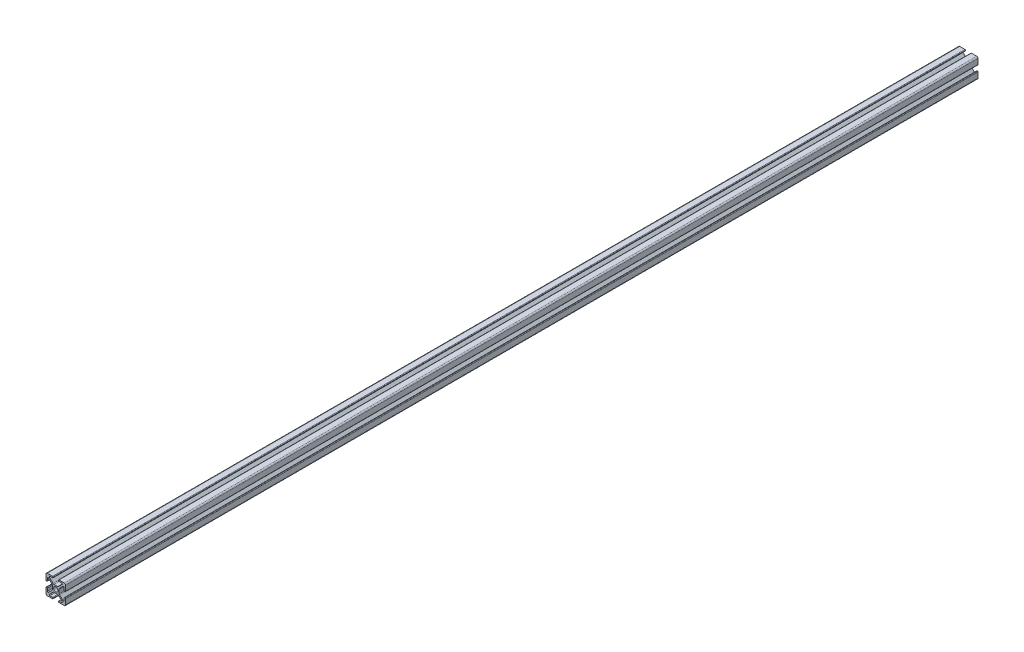
from build123d import *

# Parameters (mm, degrees)
SKETCH_1_R      = 3.35
EXTRUDE_1_DEPTH = 1400


with BuildPart() as part:
    # 草图1 → 凸台-拉伸1 (new body)
    with BuildSketch(Plane.XY):
        with BuildLine():
            Line((14.1, -4), (13.9, -4))
            ThreePointArc((13.9, -4), (13.263603897, -4.263603897), (13, -4.9))
            Line((13, -4.9), (13, -8.985786438))
            ThreePointArc((13, -8.985786438), (12.382683432, -9.90966597), (11.292893219, -9.692893219))
            Line((11.292893219, -9.692893219), (5.835786438, -4.235786438))
            ThreePointArc((5.835786438, -4.235786438), (5.402240935, -3.58693974), (5.25, -2.821572875))
            Line((5.25, -2.821572875), (5.25, 2.821572875))
            ThreePointArc((5.25, 2.821572875), (5.402240935, 3.58693974), (5.835786438, 4.235786438))
            Line((5.835786438, 4.235786438), (11.292893219, 9.692893219))
            ThreePointArc((11.292893219, 9.692893219), (12.382683432, 9.90966597), (13, 8.985786438))
            Line((13, 8.985786438), (13, 4.9))
            ThreePointArc((13, 4.9), (13.263603897, 4.263603897), (13.9, 4))
            Line((13.9, 4), (14.1, 4))
            ThreePointArc((14.1, 4), (14.736396103, 4.263603897), (15, 4.9))
            Line((15, 4.9), (15, 13))
            ThreePointArc((15, 13), (14.414213562, 14.414213562), (13, 15))
            Line((13, 15), (4.9, 15))
            ThreePointArc((4.9, 15), (4.263603897, 14.736396103), (4, 14.1))
            Line((4, 14.1), (4, 13.9))
            ThreePointArc((4, 13.9), (4.263603897, 13.263603897), (4.9, 13))
            Line((4.9, 13), (8.985786438, 13))
            ThreePointArc((8.985786438, 13), (9.90966597, 12.382683432), (9.692893219, 11.292893219))
            Line((9.692893219, 11.292893219), (4.235786438, 5.835786438))
            ThreePointArc((4.235786438, 5.835786438), (3.58693974, 5.402240935), (2.821572875, 5.25))
            Line((2.821572875, 5.25), (-2.821572875, 5.25))
            ThreePointArc((-2.821572875, 5.25), (-3.58693974, 5.402240935), (-4.235786438, 5.835786438))
            Line((-4.235786438, 5.835786438), (-9.692893219, 11.292893219))
            ThreePointArc((-9.692893219, 11.292893219), (-9.90966597, 12.382683432), (-8.985786438, 13))
            Line((-8.985786438, 13), (-4.9, 13))
            ThreePointArc((-4.9, 13), (-4.263603897, 13.263603897), (-4, 13.9))
            Line((-4, 13.9), (-4, 14.1))
            ThreePointArc((-4, 14.1), (-4.263603897, 14.736396103), (-4.9, 15))
            Line((-4.9, 15), (-13, 15))
            ThreePointArc((-13, 15), (-14.414213562, 14.414213562), (-15, 13))
            Line((-15, 13), (-15, 4.9))
            ThreePointArc((-15, 4.9), (-14.736396103, 4.263603897), (-14.1, 4))
            Line((-14.1, 4), (-13.9, 4))
            ThreePointArc((-13.9, 4), (-13.263603897, 4.263603897), (-13, 4.9))
            Line((-13, 4.9), (-13, 8.985786438))
            ThreePointArc((-13, 8.985786438), (-12.382683432, 9.90966597), (-11.292893219, 9.692893219))
            Line((-11.292893219, 9.692893219), (-5.835786438, 4.235786438))
            ThreePointArc((-5.835786438, 4.235786438), (-5.402240935, 3.58693974), (-5.25, 2.821572875))
            Line((-5.25, 2.821572875), (-5.25, -2.821572875))
            ThreePointArc((-5.25, -2.821572875), (-5.402240935, -3.58693974), (-5.835786438, -4.235786438))
            Line((-5.835786438, -4.235786438), (-11.292893219, -9.692893219))
            ThreePointArc((-11.292893219, -9.692893219), (-12.382683432, -9.90966597), (-13, -8.985786438))
            Line((-13, -8.985786438), (-13, -4.9))
            ThreePointArc((-13, -4.9), (-13.263603897, -4.263603897), (-13.9, -4))
            Line((-13.9, -4), (-14.1, -4))
            ThreePointArc((-14.1, -4), (-14.736396103, -4.263603897), (-15, -4.9))
            Line((-15, -4.9), (-15, -13))
            ThreePointArc((-15, -13), (-14.414213562, -14.414213562), (-13, -15))
            Line((-13, -15), (-4.9, -15))
            ThreePointArc((-4.9, -15), (-4.263603897, -14.736396103), (-4, -14.1))
            Line((-4, -14.1), (-4, -13.9))
            ThreePointArc((-4, -13.9), (-4.263603897, -13.263603897), (-4.9, -13))
            Line((-4.9, -13), (-8.985786438, -13))
            ThreePointArc((-8.985786438, -13), (-9.90966597, -12.382683432), (-9.692893219, -11.292893219))
            Line((-9.692893219, -11.292893219), (-4.235786438, -5.835786438))
            ThreePointArc((-4.235786438, -5.835786438), (-3.58693974, -5.402240935), (-2.821572875, -5.25))
            Line((-2.821572875, -5.25), (2.821572875, -5.25))
            ThreePointArc((2.821572875, -5.25), (3.58693974, -5.402240935), (4.235786438, -5.835786438))
            Line((4.235786438, -5.835786438), (9.692893219, -11.292893219))
            ThreePointArc((9.692893219, -11.292893219), (9.90966597, -12.382683432), (8.985786438, -13))
            Line((8.985786438, -13), (4.9, -13))
            ThreePointArc((4.9, -13), (4.263603897, -13.263603897), (4, -13.9))
            Line((4, -13.9), (4, -14.1))
            ThreePointArc((4, -14.1), (4.263603897, -14.736396103), (4.9, -15))
            Line((4.9, -15), (13, -15))
            ThreePointArc((13, -15), (14.414213562, -14.414213562), (15, -13))
            Line((15, -13), (15, -4.9))
            ThreePointArc((15, -4.9), (14.736396103, -4.263603897), (14.1, -4))
        make_face()
        Circle(SKETCH_1_R, mode=Mode.SUBTRACT)
    extrude(amount=EXTRUDE_1_DEPTH)


solid = part.part
